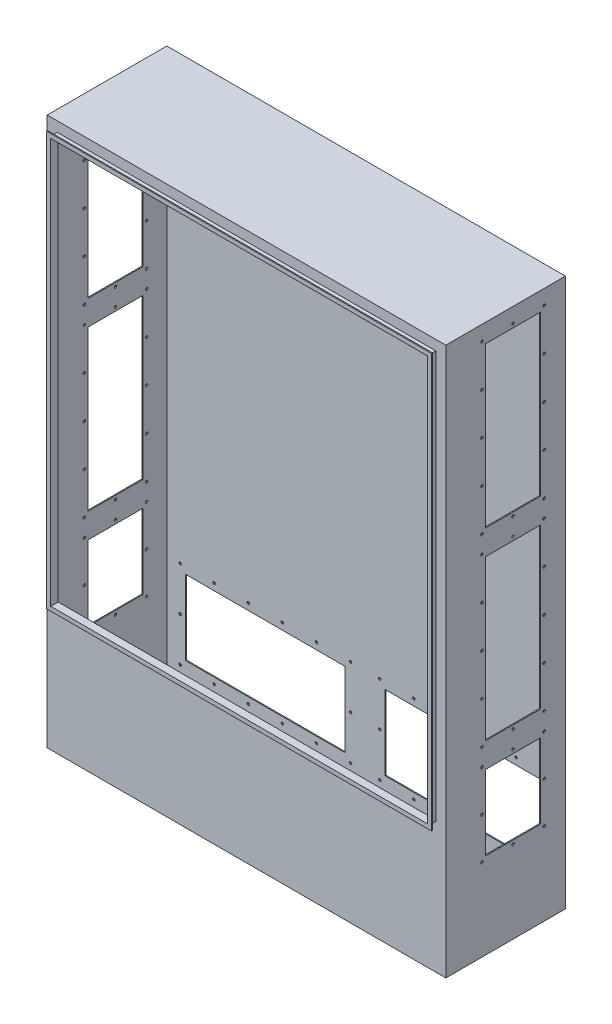
from build123d import *

# Parameters (mm, degrees)
SKETCH1_W               = 1016
SKETCH1_H               = 1397
MAIN_PANEL_DEPTH        = 2.54
SKETCH2_W               = 1016
SKETCH2_H               = 1397
SKETCH2_W_2             = 1010.92
SKETCH2_H_2             = 1391.92
WALLS_DEPTH             = 302.26
SIDE_CUTS_DEPTH         = 1271.063498413
SIDE_CUTS_DEPTH_BACK    = 1271.063498413
SKETCH3_W               = 139.7
SKETCH3_H               = 406.4
SKETCH3_H_2             = 190.5
CAM_HOLES_REACH         = 917.898
SKETCH4_R               = 3.175
SKETCH4_W               = 406.4
SKETCH4_H               = 190.5
BOTTOM_TRAP_DOOR_REACH  = 1517.086
SKETCH5_W               = 609.6
SKETCH5_H               = 101.6
SKETCH6_W               = 1016
SKETCH6_H               = 1397
SKETCH6_W_2             = 965.2
SKETCH6_H_2             = 1038.225
FRONT_FACE_DEPTH        = 2.54
SKETCH7_W               = 965.2
SKETCH7_H               = 1038.225
SKETCH7_W_2             = 960.12
SKETCH7_H_2             = 1033.145
BOSS_EXTRUDE1_DEPTH     = 19.05
SKETCH8_W               = 981.2
SKETCH8_H               = 1054.225
SKETCH8_W_2             = 965.2
SKETCH8_H_2             = 1038.225
BOSS_EXTRUDE2_DEPTH     = 2.54
CUT_EXTRUDE1_DEPTH      = 1364.402820153
CUT_EXTRUDE1_DEPTH_BACK = 1364.402820153
F_3DSKETCH1_R           = 3.175


with BuildPart() as part:
    # Sketch1 → Main Panel (new body)
    with BuildSketch(Plane.XY):
        Rectangle(SKETCH1_W, SKETCH1_H)
    extrude(amount=MAIN_PANEL_DEPTH)

    # Sketch2 → Walls (add)
    with BuildSketch(Plane.XY.offset(2.54)):
        Rectangle(SKETCH2_W, SKETCH2_H)
        Rectangle(SKETCH2_W_2, SKETCH2_H_2, mode=Mode.SUBTRACT)
    extrude(amount=WALLS_DEPTH)

    # Sketch3 → Side Cuts (cut, two sides: drawn at the far end of the back side and taken through both)
    with BuildSketch(Plane(origin=(508, 0, 0), x_dir=(0, 0, -1), z_dir=(1, 0, 0)).offset(-SIDE_CUTS_DEPTH_BACK)):
        with Locations((-133.35, 447.675)):
            Rectangle(SKETCH3_W, SKETCH3_H)
        with Locations((-133.35, -22.225)):
            Rectangle(SKETCH3_W, SKETCH3_H)
        with Locations((-133.35, -384.175)):
            Rectangle(SKETCH3_W, SKETCH3_H_2)
    extrude(amount=SIDE_CUTS_DEPTH + SIDE_CUTS_DEPTH_BACK, mode=Mode.SUBTRACT)

    # Sketch4 → Cam Holes (cut, up to next)
    with BuildSketch(Plane(origin=(0, 0, 0), x_dir=(-1, 0, 0), z_dir=(0, 0, -1)), mode=Mode.PRIVATE) as cam_holes_sk1:
        with Locations((-37.23, -536.078621574)):
            Circle(SKETCH4_R)
    cam_holes_tool1 = extrude(cam_holes_sk1.sketch, amount=-CAM_HOLES_REACH, mode=Mode.PRIVATE) & part.part
    # Sketch4 → Cam Holes (cut, up to next)
    with BuildSketch(Plane(origin=(0, 0, 0), x_dir=(-1, 0, 0), z_dir=(0, 0, -1)), mode=Mode.PRIVATE) as cam_holes_sk2:
        with Locations((-471.57, -536.078621574)):
            Circle(SKETCH4_R)
    cam_holes_tool2 = extrude(cam_holes_sk2.sketch, amount=-CAM_HOLES_REACH, mode=Mode.PRIVATE) & part.part
    # Sketch4 → Cam Holes (cut, up to next)
    with BuildSketch(Plane(origin=(0, 0, 0), x_dir=(-1, 0, 0), z_dir=(0, 0, -1)), mode=Mode.PRIVATE) as cam_holes_sk3:
        with Locations((-471.57, -647.725)):
            Circle(SKETCH4_R)
    cam_holes_tool3 = extrude(cam_holes_sk3.sketch, amount=-CAM_HOLES_REACH, mode=Mode.PRIVATE) & part.part
    # Sketch4 → Cam Holes (cut, up to next)
    with BuildSketch(Plane(origin=(0, 0, 0), x_dir=(-1, 0, 0), z_dir=(0, 0, -1)), mode=Mode.PRIVATE) as cam_holes_sk4:
        with Locations((-37.23, -647.725)):
            Circle(SKETCH4_R)
    cam_holes_tool4 = extrude(cam_holes_sk4.sketch, amount=-CAM_HOLES_REACH, mode=Mode.PRIVATE) & part.part
    # Sketch4 → Cam Holes (cut, up to next)
    with BuildSketch(Plane(origin=(0, 0, 0), x_dir=(-1, 0, 0), z_dir=(0, 0, -1)), mode=Mode.PRIVATE) as cam_holes_sk5:
        with Locations((-37.23, -424.432243149)):
            Circle(SKETCH4_R)
    cam_holes_tool5 = extrude(cam_holes_sk5.sketch, amount=-CAM_HOLES_REACH, mode=Mode.PRIVATE) & part.part
    # Sketch4 → Cam Holes (cut, up to next)
    with BuildSketch(Plane(origin=(0, 0, 0), x_dir=(-1, 0, 0), z_dir=(0, 0, -1)), mode=Mode.PRIVATE) as cam_holes_sk6:
        with Locations((-471.57, -424.432243149)):
            Circle(SKETCH4_R)
    cam_holes_tool6 = extrude(cam_holes_sk6.sketch, amount=-CAM_HOLES_REACH, mode=Mode.PRIVATE) & part.part
    # Sketch4 → Cam Holes (cut, up to next)
    with BuildSketch(Plane(origin=(0, 0, 0), x_dir=(-1, 0, 0), z_dir=(0, 0, -1)), mode=Mode.PRIVATE) as cam_holes_sk7:
        with Locations((-124.098, -424.432243149)):
            Circle(SKETCH4_R)
    cam_holes_tool7 = extrude(cam_holes_sk7.sketch, amount=-CAM_HOLES_REACH, mode=Mode.PRIVATE) & part.part
    # Sketch4 → Cam Holes (cut, up to next)
    with BuildSketch(Plane(origin=(0, 0, 0), x_dir=(-1, 0, 0), z_dir=(0, 0, -1)), mode=Mode.PRIVATE) as cam_holes_sk8:
        with Locations((-210.966, -424.432243149)):
            Circle(SKETCH4_R)
    cam_holes_tool8 = extrude(cam_holes_sk8.sketch, amount=-CAM_HOLES_REACH, mode=Mode.PRIVATE) & part.part
    # Sketch4 → Cam Holes (cut, up to next)
    with BuildSketch(Plane(origin=(0, 0, 0), x_dir=(-1, 0, 0), z_dir=(0, 0, -1)), mode=Mode.PRIVATE) as cam_holes_sk9:
        with Locations((-297.834, -424.432243149)):
            Circle(SKETCH4_R)
    cam_holes_tool9 = extrude(cam_holes_sk9.sketch, amount=-CAM_HOLES_REACH, mode=Mode.PRIVATE) & part.part
    # Sketch4 → Cam Holes (cut, up to next)
    with BuildSketch(Plane(origin=(0, 0, 0), x_dir=(-1, 0, 0), z_dir=(0, 0, -1)), mode=Mode.PRIVATE) as cam_holes_sk10:
        with Locations((-384.702, -424.432243149)):
            Circle(SKETCH4_R)
    cam_holes_tool10 = extrude(cam_holes_sk10.sketch, amount=-CAM_HOLES_REACH, mode=Mode.PRIVATE) & part.part
    # Sketch4 → Cam Holes (cut, up to next)
    with BuildSketch(Plane(origin=(0, 0, 0), x_dir=(-1, 0, 0), z_dir=(0, 0, -1)), mode=Mode.PRIVATE) as cam_holes_sk11:
        with Locations((-384.702, -647.725)):
            Circle(SKETCH4_R)
    cam_holes_tool11 = extrude(cam_holes_sk11.sketch, amount=-CAM_HOLES_REACH, mode=Mode.PRIVATE) & part.part
    # Sketch4 → Cam Holes (cut, up to next)
    with BuildSketch(Plane(origin=(0, 0, 0), x_dir=(-1, 0, 0), z_dir=(0, 0, -1)), mode=Mode.PRIVATE) as cam_holes_sk12:
        with Locations((-297.834, -647.725)):
            Circle(SKETCH4_R)
    cam_holes_tool12 = extrude(cam_holes_sk12.sketch, amount=-CAM_HOLES_REACH, mode=Mode.PRIVATE) & part.part
    # Sketch4 → Cam Holes (cut, up to next)
    with BuildSketch(Plane(origin=(0, 0, 0), x_dir=(-1, 0, 0), z_dir=(0, 0, -1)), mode=Mode.PRIVATE) as cam_holes_sk13:
        with Locations((-210.966, -647.725)):
            Circle(SKETCH4_R)
    cam_holes_tool13 = extrude(cam_holes_sk13.sketch, amount=-CAM_HOLES_REACH, mode=Mode.PRIVATE) & part.part
    # Sketch4 → Cam Holes (cut, up to next)
    with BuildSketch(Plane(origin=(0, 0, 0), x_dir=(-1, 0, 0), z_dir=(0, 0, -1)), mode=Mode.PRIVATE) as cam_holes_sk14:
        with Locations((-124.098, -647.725)):
            Circle(SKETCH4_R)
    cam_holes_tool14 = extrude(cam_holes_sk14.sketch, amount=-CAM_HOLES_REACH, mode=Mode.PRIVATE) & part.part
    # Sketch4 → Cam Holes (cut, up to next)
    with BuildSketch(Plane(origin=(0, 0, 0), x_dir=(-1, 0, 0), z_dir=(0, 0, -1)), mode=Mode.PRIVATE) as cam_holes_sk15:
        with Locations((-254.4, -536.575)):
            Rectangle(SKETCH4_W, SKETCH4_H)
    cam_holes_tool15 = extrude(cam_holes_sk15.sketch, amount=-CAM_HOLES_REACH, mode=Mode.PRIVATE) & part.part
    cam_holes_1 = cam_holes_tool1.solids().sort_by_distance((37.23, -536.078622, 0))[0]
    add(cam_holes_1, mode=Mode.SUBTRACT)
    cam_holes_2 = cam_holes_tool2.solids().sort_by_distance((471.57, -536.078622, 0))[0]
    add(cam_holes_2, mode=Mode.SUBTRACT)
    cam_holes_3 = cam_holes_tool3.solids().sort_by_distance((471.57, -647.725, 0))[0]
    add(cam_holes_3, mode=Mode.SUBTRACT)
    cam_holes_4 = cam_holes_tool4.solids().sort_by_distance((37.23, -647.725, 0))[0]
    add(cam_holes_4, mode=Mode.SUBTRACT)
    cam_holes_5 = cam_holes_tool5.solids().sort_by_distance((37.23, -424.432243, 0))[0]
    add(cam_holes_5, mode=Mode.SUBTRACT)
    cam_holes_6 = cam_holes_tool6.solids().sort_by_distance((471.57, -424.432243, 0))[0]
    add(cam_holes_6, mode=Mode.SUBTRACT)
    cam_holes_7 = cam_holes_tool7.solids().sort_by_distance((124.098, -424.432243, 0))[0]
    add(cam_holes_7, mode=Mode.SUBTRACT)
    cam_holes_8 = cam_holes_tool8.solids().sort_by_distance((210.966, -424.432243, 0))[0]
    add(cam_holes_8, mode=Mode.SUBTRACT)
    cam_holes_9 = cam_holes_tool9.solids().sort_by_distance((297.834, -424.432243, 0))[0]
    add(cam_holes_9, mode=Mode.SUBTRACT)
    cam_holes_10 = cam_holes_tool10.solids().sort_by_distance((384.702, -424.432243, 0))[0]
    add(cam_holes_10, mode=Mode.SUBTRACT)
    cam_holes_11 = cam_holes_tool11.solids().sort_by_distance((384.702, -647.725, 0))[0]
    add(cam_holes_11, mode=Mode.SUBTRACT)
    cam_holes_12 = cam_holes_tool12.solids().sort_by_distance((297.834, -647.725, 0))[0]
    add(cam_holes_12, mode=Mode.SUBTRACT)
    cam_holes_13 = cam_holes_tool13.solids().sort_by_distance((210.966, -647.725, 0))[0]
    add(cam_holes_13, mode=Mode.SUBTRACT)
    cam_holes_14 = cam_holes_tool14.solids().sort_by_distance((124.098, -647.725, 0))[0]
    add(cam_holes_14, mode=Mode.SUBTRACT)
    cam_holes_15 = cam_holes_tool15.solids().sort_by_distance((254.4, -536.575, 0))[0]
    add(cam_holes_15, mode=Mode.SUBTRACT)
    cam_holes = cam_holes_1 + cam_holes_2 + cam_holes_3 + cam_holes_4 + cam_holes_5 + cam_holes_6 + cam_holes_7 + cam_holes_8 + cam_holes_9 + cam_holes_10 + cam_holes_11 + cam_holes_12 + cam_holes_13 + cam_holes_14 + cam_holes_15  # Cam Holes as one shape, for the pattern or mirror that repeats it

    # Sketch5 → Bottom Trap Door (cut, up to next)
    with BuildSketch(Plane(origin=(0, -695.96, 0), x_dir=(1, 0, 0), z_dir=(0, 1, 0)), mode=Mode.PRIVATE) as bottom_trap_door_sk1:
        with Locations((0, -168.275)):
            Rectangle(SKETCH5_W, SKETCH5_H)
    bottom_trap_door_tool1 = extrude(bottom_trap_door_sk1.sketch, amount=-BOTTOM_TRAP_DOOR_REACH, mode=Mode.PRIVATE) & part.part
    add(bottom_trap_door_tool1.solids().sort_by_distance((0, -695.96, 168.275))[0], mode=Mode.SUBTRACT)

    # Sketch6 → Front Face (add)
    with BuildSketch(Plane.XY.offset(304.8)):
        Rectangle(SKETCH6_W, SKETCH6_H)
        with Locations((0, 153.9875)):
            Rectangle(SKETCH6_W_2, SKETCH6_H_2, mode=Mode.SUBTRACT)
    extrude(amount=-FRONT_FACE_DEPTH)

    # 3DSketch1 → Cut-Extrude1 (cut, two sides: drawn at the far end of the back side and taken through both)
    with BuildSketch(Plane(origin=(508, 190.5, 133.35), x_dir=(0, -0.9932453201068373, 0.11603333178818209), z_dir=(1, 0, 0)).offset(-CUT_EXTRUDE1_DEPTH_BACK)):
        with Locations(Location((0, 0, 0), (0, 0, 276.663229622))):
            Circle(F_3DSKETCH1_R)
        with Locations(Location((-159.003955549, 61.339570433, 0), (0, 0, 276.663229622))):
            Circle(F_3DSKETCH1_R)
        with Locations(Location((-264.648010909, 48.997975181, 0), (0, 0, 276.663229622))):
            Circle(F_3DSKETCH1_R)
        with Locations(Location((-370.292066269, 36.656379929, 0), (0, 0, 276.663229622))):
            Circle(F_3DSKETCH1_R)
        with Locations(Location((-475.936121629, 24.314784676, 0), (0, 0, 276.663229622))):
            Circle(F_3DSKETCH1_R)
        with Locations(Location((-457.515830208, -133.362909891, 0), (0, 0, 276.663229622))):
            Circle(F_3DSKETCH1_R)
        with Locations(Location((-466.725975918, -54.524062607, 0), (0, 0, 276.663229622))):
            Circle(F_3DSKETCH1_R)
        with Locations(Location((-9.210145711, 78.838847283, 0), (0, 0, 276.663229622))):
            Circle(F_3DSKETCH1_R)
        with Locations(Location((96.433909649, 91.180442536, 0), (0, 0, 276.663229622))):
            Circle(F_3DSKETCH1_R)
        with Locations(Location((9.210145711, -78.838847283, 0), (0, 0, 276.663229622))):
            Circle(F_3DSKETCH1_R)
        with Locations(Location((-140.583664128, -96.338124134, 0), (0, 0, 276.663229622))):
            Circle(F_3DSKETCH1_R)
        with Locations(Location((-34.939608768, -83.996528881, 0), (0, 0, 276.663229622))):
            Circle(F_3DSKETCH1_R)
        with Locations(Location((-44.149754479, -5.157681598, 0), (0, 0, 276.663229622))):
            Circle(F_3DSKETCH1_R)
        with Locations(Location((-53.359900189, 73.681165685, 0), (0, 0, 276.663229622))):
            Circle(F_3DSKETCH1_R)
        with Locations(Location((307.722020369, 115.86363304, 0), (0, 0, 276.663229622))):
            Circle(F_3DSKETCH1_R)
        with Locations(Location((202.077965009, 103.522037788, 0), (0, 0, 276.663229622))):
            Circle(F_3DSKETCH1_R)
        with Locations(Location((-351.871774848, -121.021314638, 0), (0, 0, 276.663229622))):
            Circle(F_3DSKETCH1_R)
        with Locations(Location((-246.227719488, -108.679719386, 0), (0, 0, 276.663229622))):
            Circle(F_3DSKETCH1_R)
        with Locations(Location((431.78636715, -29.472466274, 0), (0, 0, 276.663229622))):
            Circle(F_3DSKETCH1_R)
        with Locations(Location((326.14231179, -41.814061527, 0), (0, 0, 276.663229622))):
            Circle(F_3DSKETCH1_R)
        with Locations(Location((413.366075729, 128.205228293, 0), (0, 0, 276.663229622))):
            Circle(F_3DSKETCH1_R)
        with Locations(Location((220.49825643, -54.155656779, 0), (0, 0, 276.663229622))):
            Circle(F_3DSKETCH1_R)
        with Locations(Location((422.576221439, 49.366381009, 0), (0, 0, 276.663229622))):
            Circle(F_3DSKETCH1_R)
        with Locations(Location((114.854201071, -66.497252031, 0), (0, 0, 276.663229622))):
            Circle(F_3DSKETCH1_R)
        with Locations(Location((561.583108622, 145.520302229, 0), (0, 0, 276.663229622))):
            Circle(F_3DSKETCH1_R)
        with Locations(Location((580.003400043, -12.157392338, 0), (0, 0, 276.663229622))):
            Circle(F_3DSKETCH1_R)
        with Locations(Location((475.936121629, -24.314784676, 0), (0, 0, 276.663229622))):
            Circle(F_3DSKETCH1_R)
        with Locations(Location((457.515830208, 133.362909891, 0), (0, 0, 276.663229622))):
            Circle(F_3DSKETCH1_R)
        with Locations(Location((674.860532747, 78.838847283, 0), (0, 0, 276.663229622))):
            Circle(F_3DSKETCH1_R)
        with Locations(Location((466.725975918, 54.524062607, 0), (0, 0, 276.663229622))):
            Circle(F_3DSKETCH1_R)
        with Locations(Location((684.070678457, 0, 0), (0, 0, 276.663229622))):
            Circle(F_3DSKETCH1_R)
        with Locations(Location((665.650387036, 157.677694567, 0), (0, 0, 276.663229622))):
            Circle(F_3DSKETCH1_R)
    extrude(amount=CUT_EXTRUDE1_DEPTH + CUT_EXTRUDE1_DEPTH_BACK, mode=Mode.SUBTRACT)

    # Mirror1: Cam Holes across plane
    add(cam_holes.mirror(Plane(origin=(0, 0, 0), x_dir=(0, 0, 1), z_dir=(1, 0, 0))), mode=Mode.SUBTRACT)


with BuildPart() as body_2:
    # Sketch7 → Boss-Extrude1 (new body)
    with BuildSketch(Plane.XY.offset(304.8)):
        with Locations((0, 153.9875)):
            Rectangle(SKETCH7_W, SKETCH7_H)
        with Locations((0, 153.9875)):
            Rectangle(SKETCH7_W_2, SKETCH7_H_2, mode=Mode.SUBTRACT)
    extrude(amount=BOSS_EXTRUDE1_DEPTH)

    # Sketch8 → Boss-Extrude2 (add)
    with BuildSketch(Plane.XY.offset(323.85)):
        with Locations((0, 153.9875)):
            Rectangle(SKETCH8_W, SKETCH8_H)
        with Locations((0, 153.9875)):
            Rectangle(SKETCH8_W_2, SKETCH8_H_2, mode=Mode.SUBTRACT)
    extrude(amount=-BOSS_EXTRUDE2_DEPTH)


solid = Compound([part.part, body_2.part])
